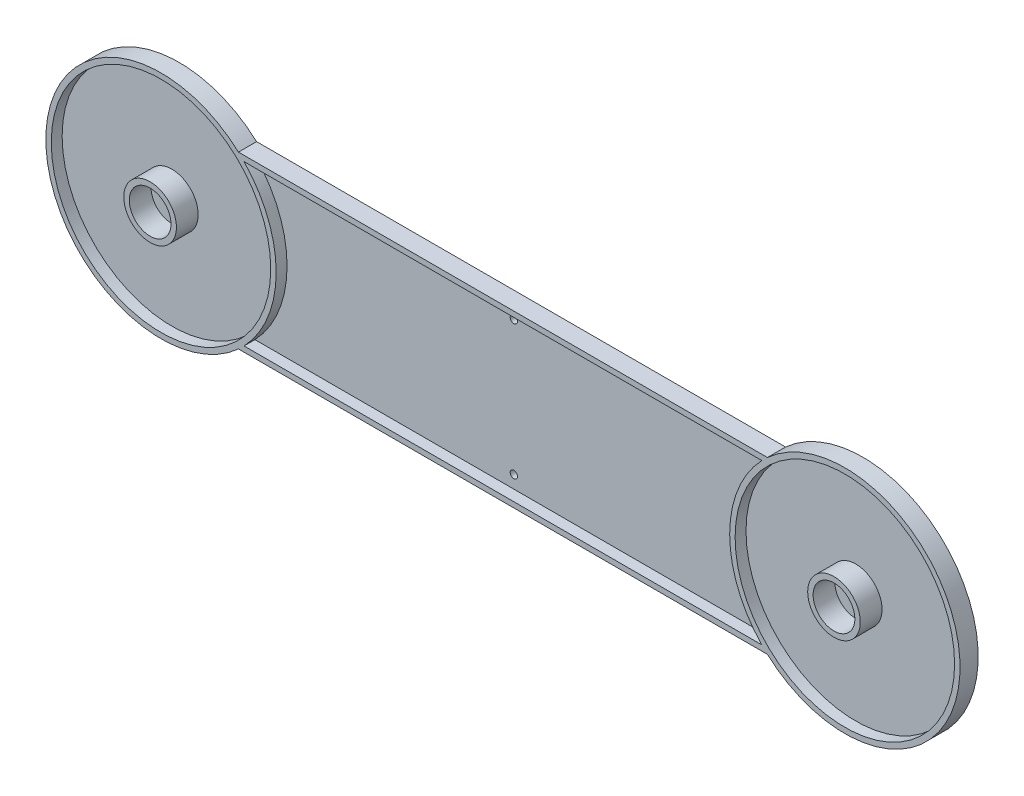
from build123d import *
from build123d.topology import SkipClean

# Parameters (mm, degrees)
BOSS_EXTRUDE1_DEPTH     = 2
BOSS_EXTRUDE2_DEPTH     = 3
CUT_EXTRUDE1_DEPTH      = 130.973314569
CUT_EXTRUDE1_DEPTH_BACK = 130.973314569
SKETCH3_R               = 1
SKETCH4_R               = 7.25
SKETCH4_R_2             = 5.75
BOSS_EXTRUDE3_DEPTH     = 6


with BuildPart() as part:
    # Sketch1 → Boss-Extrude1 (new body)
    with BuildSketch(Plane.XY):
        with BuildLine():
            Line((72.900234193, -23.5), (-72.900234193, -23.5))
            ThreePointArc((-72.900234193, -23.5), (-126, 0), (-72.900234193, 23.5))
            Line((-72.900234193, 23.5), (72.900234193, 23.5))
            ThreePointArc((72.900234193, 23.5), (126, 0), (72.900234193, -23.5))
        make_face()
    extrude(amount=BOSS_EXTRUDE1_DEPTH)

    # Sketch2 → Boss-Extrude2 (add)
    with SkipClean():  # the faces are left unmerged after this step: merging them gives an invalid solid
        with BuildSketch(Plane.XY.offset(2)):
            with BuildLine():
                ThreePointArc((-72.900234193, 23.5), (-126, 0), (-72.900234193, -23.5))
                Line((-72.900234193, -23.5), (72.900234193, -23.5))
                ThreePointArc((72.900234193, -23.5), (126, 0), (72.900234193, 23.5))
                Line((72.900234193, 23.5), (-72.900234193, 23.5))
            make_face()
            with BuildLine():
                ThreePointArc((-73.487955303, -22), (-124.5, 0), (-73.487955303, 22))
                ThreePointArc((-73.487955303, 22), (-66.473081956, 11.979370766), (-64, 0))
                ThreePointArc((-64, 0), (-66.473081956, -11.979370766), (-73.487955303, -22))
            make_face(mode=Mode.SUBTRACT)
            with BuildLine():
                Line((71.357588594, -22), (-71.357588594, -22))
                ThreePointArc((-71.357588594, -22), (-62.5, 0), (-71.357588594, 22))
                Line((-71.357588594, 22), (71.357588594, 22))
                ThreePointArc((71.357588594, 22), (62.5, 0), (71.357588594, -22))
            make_face(mode=Mode.SUBTRACT)
            with BuildLine():
                ThreePointArc((124.5, 0), (106.229370766, -27.776918044), (73.487955303, -22))
                ThreePointArc((73.487955303, -22), (64, 0), (73.487955303, 22))
                ThreePointArc((73.487955303, 22), (106.229370766, 27.776918044), (124.5, 0))
            make_face(mode=Mode.SUBTRACT)
        extrude(amount=BOSS_EXTRUDE2_DEPTH)

    # Sketch3 → Cut-Extrude1 (cut, two sides: drawn at the far end of the back side and taken through both)
    with SkipClean():  # the faces are left unmerged after this step: merging them gives an invalid solid
        with BuildSketch(Plane.XY.offset(2).offset(-CUT_EXTRUDE1_DEPTH_BACK)):
            with Locations((0, -18.5)):
                Circle(SKETCH3_R)
            with Locations((0, 18.5)):
                Circle(SKETCH3_R)
        extrude(amount=CUT_EXTRUDE1_DEPTH + CUT_EXTRUDE1_DEPTH_BACK, mode=Mode.SUBTRACT)

    # Sketch4 → Boss-Extrude3 (add)
    with SkipClean():  # the faces are left unmerged after this step: merging them gives an invalid solid
        with BuildSketch(Plane.XY.offset(2)):
            with Locations((-94.25, 0)):
                Circle(SKETCH4_R)
            with Locations((-94.25, 0)):
                Circle(SKETCH4_R_2, mode=Mode.SUBTRACT)
        boss_extrude3 = extrude(amount=BOSS_EXTRUDE3_DEPTH)

    # Mirror1: Boss-Extrude3 across plane
    with SkipClean():  # the faces are left unmerged after this step: merging them gives an invalid solid
        add(boss_extrude3.mirror(Plane(origin=(0, 0, 0), x_dir=(0, 0, 1), z_dir=(1, 0, 0))))


solid = part.part
